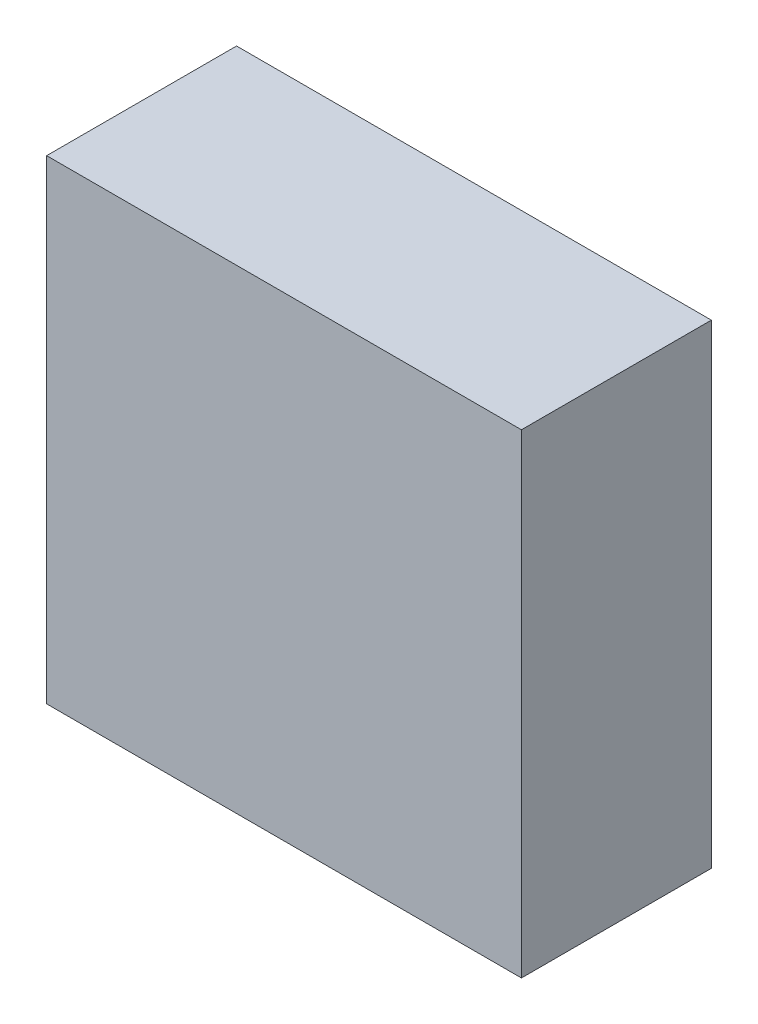
from build123d import *

# Parameters (mm, degrees)
SKETCH_1_W      = 50
SKETCH_1_H      = 50
EXTRUDE_1_DEPTH = 20


with BuildPart() as part:
    # 草图1 → 凸台-拉伸1 (new body)
    with BuildSketch(Plane.XY):
        Rectangle(SKETCH_1_W, SKETCH_1_H)
    extrude(amount=EXTRUDE_1_DEPTH)


solid = part.part
